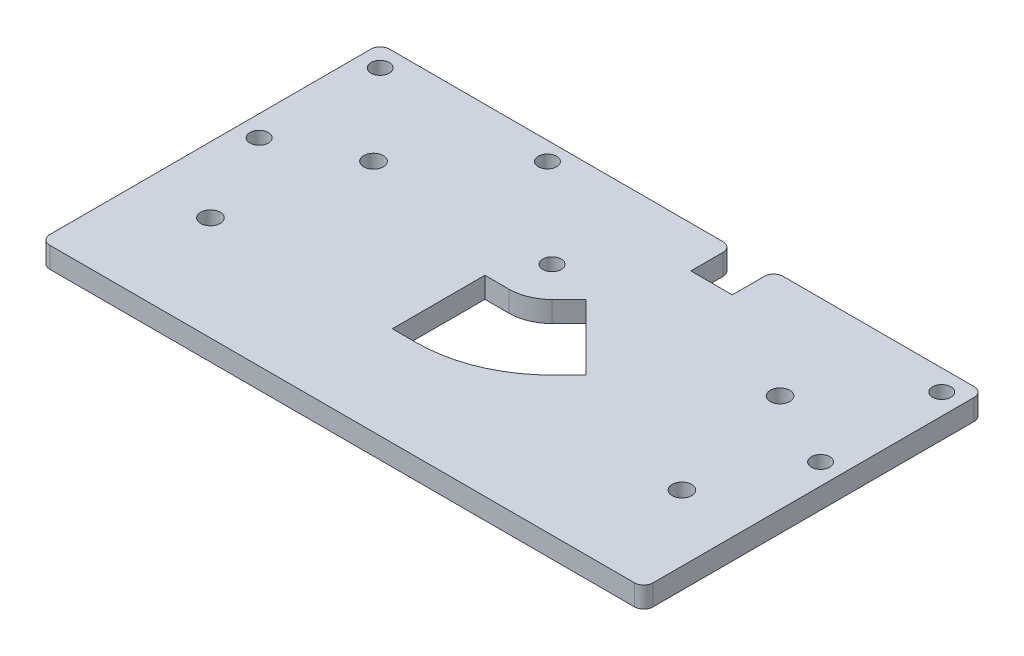
from build123d import *

# Parameters (mm, degrees)
SKETCH1_R           = 1.975
SKETCH1_R_2         = 2.1082
BOSS_EXTRUDE1_DEPTH = 4.5


with BuildPart() as part:
    # Sketch1 → Boss-Extrude1 (new body)
    with BuildSketch(Plane(origin=(0, 0, 0), x_dir=(1, 0, 0), z_dir=(0, 1, 0))):
        with BuildLine():
            Line((63, 20.3), (21.8, 20.3))
            ThreePointArc((21.8, 20.3), (20.385786438, 19.714213562), (19.8, 18.3))
            Line((19.8, 18.3), (19.8, 11.37))
            Line((19.8, 11.37), (10.87, 11.37))
            Line((10.87, 11.37), (10.87, 18.3))
            ThreePointArc((10.87, 18.3), (10.284213562, 19.714213562), (8.87, 20.3))
            Line((8.87, 20.3), (-63, 20.3))
            ThreePointArc((-63, 20.3), (-64.414213562, 19.714213562), (-65, 18.3))
            Line((-65, 18.3), (-65, -50.9))
            ThreePointArc((-65, -50.9), (-64.414213562, -52.314213562), (-63, -52.9))
            Line((-63, -52.9), (63, -52.9))
            ThreePointArc((63, -52.9), (64.414213562, -52.314213562), (65, -50.9))
            Line((65, -50.9), (65, 18.3))
            ThreePointArc((65, 18.3), (64.414213562, 19.714213562), (63, 20.3))
        make_face()
        with Locations(Location((-60.5, 15.8, 0), (0, 0, 270))):
            Circle(SKETCH1_R, mode=Mode.SUBTRACT)
        with Locations(Location((60.5, 15.8, 0), (0, 0, 90))):
            Circle(SKETCH1_R, mode=Mode.SUBTRACT)
        with Locations(Location((60.5, -10.3, 0), (0, 0, 270))):
            Circle(SKETCH1_R, mode=Mode.SUBTRACT)
        with Locations(Location((-60.5, -10.3, 0), (0, 0, 90))):
            Circle(SKETCH1_R, mode=Mode.SUBTRACT)
        with Locations(Location((-25.004260819, 16.35, 0), (0, 0, 270))):
            Circle(SKETCH1_R, mode=Mode.SUBTRACT)
        with Locations(Location((-5.328324842, -2.339651524, 0), (0, 0, 270))):
            Circle(SKETCH1_R, mode=Mode.SUBTRACT)
        with Locations(Location((-50.8, -30.4845, 0), (0, 0, 270))):
            Circle(SKETCH1_R_2, mode=Mode.SUBTRACT)
        with Locations(Location((50.8, -30.4845, 0), (0, 0, 90))):
            Circle(SKETCH1_R_2, mode=Mode.SUBTRACT)
        with Locations(Location((-43.8023, -2.339651524, 0), (0, 0, 270))):
            Circle(SKETCH1_R_2, mode=Mode.SUBTRACT)
        with Locations(Location((43.8023, -2.339651524, 0), (0, 0, 90))):
            Circle(SKETCH1_R_2, mode=Mode.SUBTRACT)
        with BuildLine():
            Line((-5.328324842, -31.589651524), (-10.508324842, -31.589651524))
            Line((-10.508324842, -31.589651524), (-10.5114167, -11.629651524))
            Line((-10.5114167, -11.629651524), (-5.328324842, -11.629651524))
            ThreePointArc((-5.328324842, -11.629651524), (-1.773195755, -10.922492381), (1.240697155, -8.908673522))
            Line((1.240697155, -8.908673522), (4.903510282, -5.245860395))
            Line((4.903510282, -5.245860395), (19.017361634, -19.359711748))
            Line((19.017361634, -19.359711748), (15.354548508, -23.022524874))
            ThreePointArc((15.354548508, -23.022524874), (5.865165555, -29.36312785), (-5.328324842, -31.589651524))
        make_face(mode=Mode.SUBTRACT)
    extrude(amount=BOSS_EXTRUDE1_DEPTH)


solid = part.part
